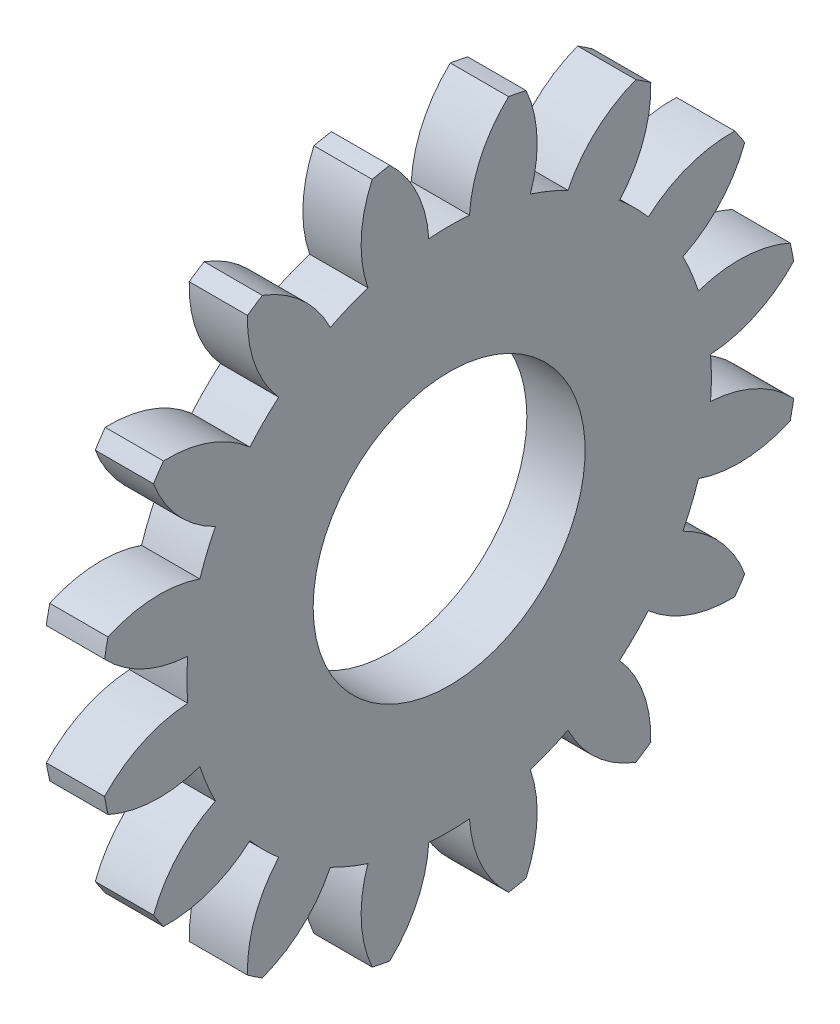
from build123d import *

# Parameters (mm, degrees)
BASPROSKE_W     = 1.5
BASPROSKE_H     = 9
TOOTHCUT_DEPTH  = 13.816005618
TEETHCUTS_COUNT = 16
TEETHCUTS_ANGLE = 337.5
BORSKE_R        = 3.5
BORE_DEPTH      = 50.0000508


with BuildPart() as part:
    # BasProSke → Base-Revolve (revolve)
    with BuildSketch(Plane(origin=(0, 0, 0), x_dir=(1, 0, 0), z_dir=(0, 1, 0)), mode=Mode.PRIVATE) as base_revolve_sk:
        with Locations((0.75, 4.5)):
            Rectangle(BASPROSKE_W, BASPROSKE_H)
    revolve(base_revolve_sk.sketch.rotate(Axis((-10, 0, 0), (1, 0, 0)), 180), axis=Axis((-10, 0, 0), (1, 0, 0)))

    # TooCutSke → ToothCut (cut, through all)
    with BuildSketch(Plane(origin=(0, 0, 0), x_dir=(0, 0, -1), z_dir=(1, 0, 0))):
        with BuildLine():
            ThreePointArc((0.523792937, 6.728643397), (0, 6.749), (-0.523792937, 6.728643397))
            ThreePointArc((-0.523792937, 6.728643397), (-0.828704482, 7.90962059), (-1.553355277, 8.890721711))
            ThreePointArc((-1.553355277, 8.890721711), (0, 9.0254), (1.553355277, 8.890721711))
            ThreePointArc((1.553355277, 8.890721711), (0.828704482, 7.90962059), (0.523792937, 6.728643397))
        make_face()
    toothcut = extrude(amount=TOOTHCUT_DEPTH, mode=Mode.SUBTRACT)

    # TeethCuts: ToothCut ×16 about axis
    teethcuts_axis = Axis((-10, 0, 0), (1, 0, 0))
    for i in range(1, TEETHCUTS_COUNT):
        add(toothcut.rotate(teethcuts_axis, i * TEETHCUTS_ANGLE / (TEETHCUTS_COUNT - 1)), mode=Mode.SUBTRACT)

    # BorSke → Bore (cut, symmetric)
    with BuildSketch(Plane(origin=(0, 0, 0), x_dir=(0, 0, -1), z_dir=(1, 0, 0))):
        with Locations(Location((0, 0, 0), (0, 0, 180))):
            Circle(BORSKE_R)
    extrude(amount=BORE_DEPTH, both=True, mode=Mode.SUBTRACT)


solid = part.part
